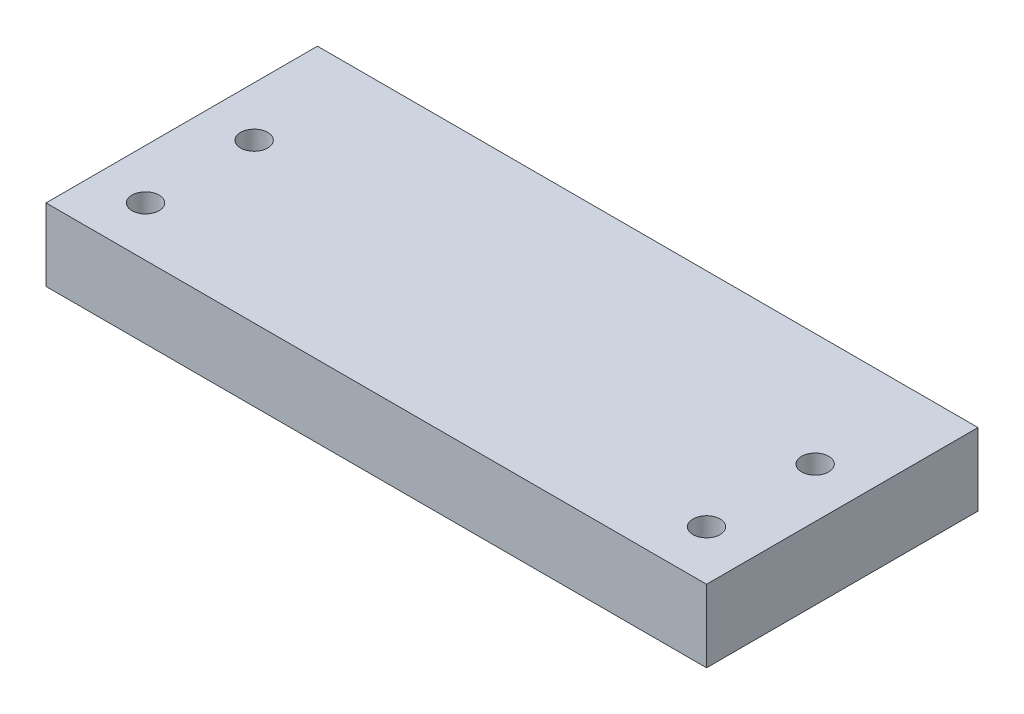
from build123d import *

# Parameters (mm, degrees)
SKETCH_1_W          = 73
SKETCH_1_H          = 30
EXTRUDE_1_DEPTH     = 8
SKETCH_2_R          = 1.5
CUT_EXTRUDE_1_DEPTH = 45


with BuildPart() as part:
    # 草图1 → 凸台-拉伸1 (new body)
    with BuildSketch(Plane(origin=(0, 0, 0), x_dir=(1, 0, 0), z_dir=(0, 1, 0))):
        Rectangle(SKETCH_1_W, SKETCH_1_H)
    extrude(amount=EXTRUDE_1_DEPTH)

    # 草图2 → 切除-拉伸1 (cut, symmetric)
    with BuildSketch(Plane(origin=(59.282070169, -28, -16.5), x_dir=(1, 0, 0), z_dir=(0, -1, 0))):
        with Locations((-28.282070169, 14)):
            Circle(SKETCH_2_R)
        with Locations((-90.282070169, 14)):
            Circle(SKETCH_2_R)
        with Locations((-90.282070169, 26)):
            Circle(SKETCH_2_R)
        with Locations((-28.282070169, 26)):
            Circle(SKETCH_2_R)
    extrude(amount=CUT_EXTRUDE_1_DEPTH, both=True, mode=Mode.SUBTRACT)


solid = part.part
